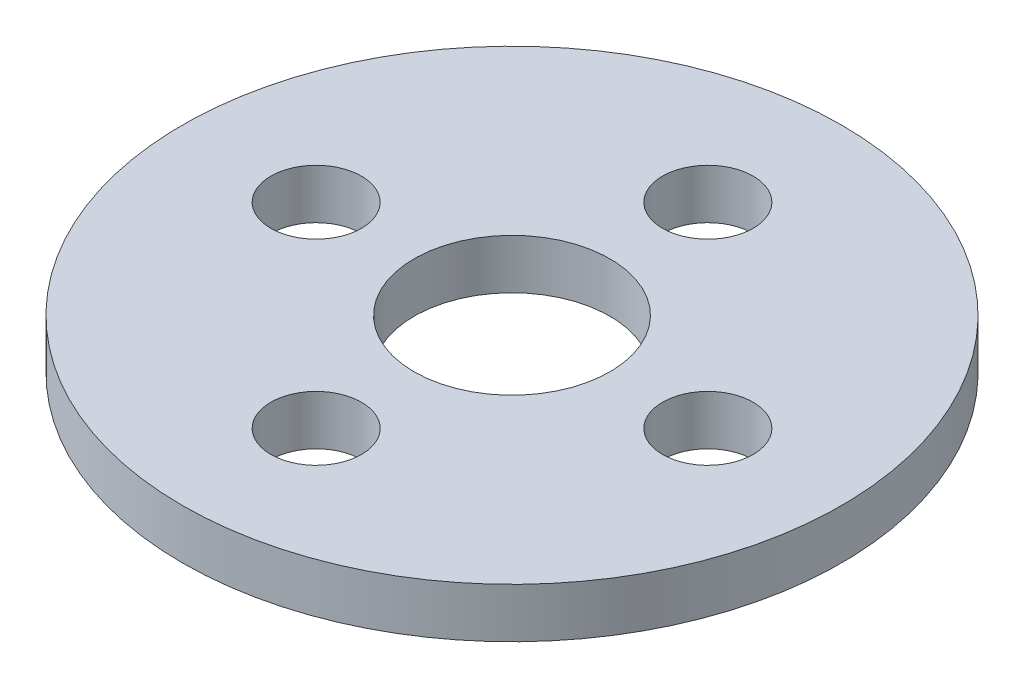
from build123d import *

# Parameters (mm, degrees)
SKETCH1_R           = 13.462
SKETCH1_R_2         = 4
SKETCH1_R_3         = 1.85
BOSS_EXTRUDE1_DEPTH = 2.032


with BuildPart() as part:
    # Sketch1 → Boss-Extrude1 (new body)
    with BuildSketch(Plane(origin=(0, 0, 0), x_dir=(1, 0, 0), z_dir=(0, 1, 0))):
        with Locations(Location((0, 0, 0), (0, 0, 270))):
            Circle(SKETCH1_R)
        with Locations(Location((0, 0, 0), (0, 0, 270))):
            Circle(SKETCH1_R_2, mode=Mode.SUBTRACT)
        with Locations(Location((8, 0, 0), (0, 0, 270))):
            Circle(SKETCH1_R_3, mode=Mode.SUBTRACT)
        with Locations(Location((-8, 0, 0), (0, 0, 270))):
            Circle(SKETCH1_R_3, mode=Mode.SUBTRACT)
        with Locations(Location((0, -8, 0), (0, 0, 270))):
            Circle(SKETCH1_R_3, mode=Mode.SUBTRACT)
        with Locations(Location((0, 8, 0), (0, 0, 270))):
            Circle(SKETCH1_R_3, mode=Mode.SUBTRACT)
    extrude(amount=BOSS_EXTRUDE1_DEPTH)


solid = part.part
